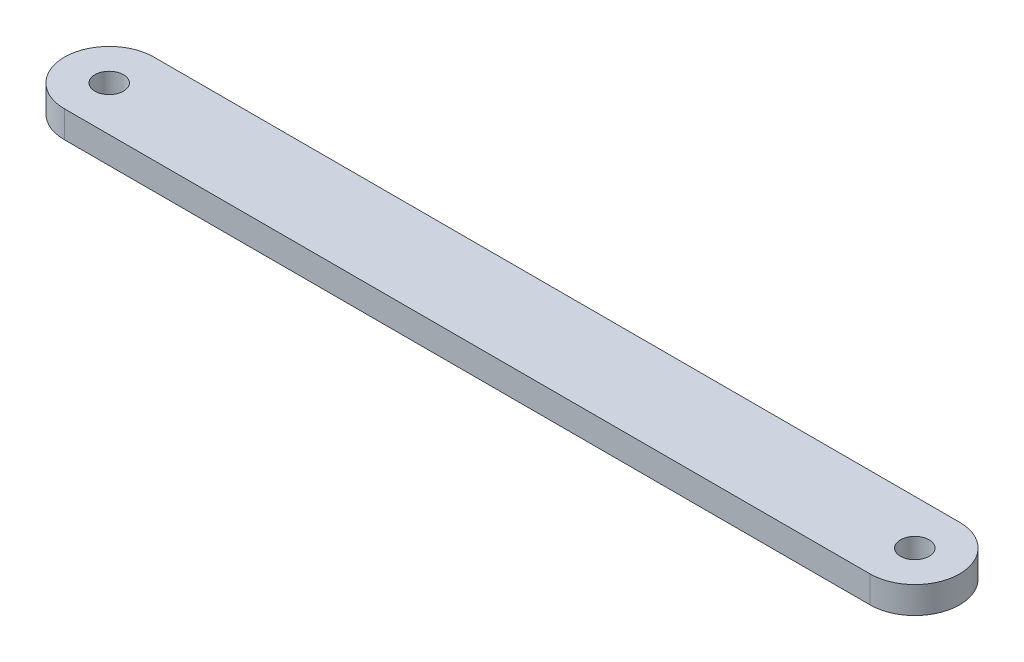
from build123d import *

# Parameters (mm, degrees)
SKETCH_1_R      = 1.6
EXTRUDE_1_DEPTH = 3


with BuildPart() as part:
    # ｽｹｯﾁ1 → ﾎﾞｽ - 押し出し1 (new body)
    with BuildSketch(Plane(origin=(0, 0, 0), x_dir=(1, 0, 0), z_dir=(0, 1, 0))):
        with BuildLine():
            Line((0, -5), (90, -5))
            ThreePointArc((90, -5), (95, 0), (90, 5))
            Line((90, 5), (0, 5))
            ThreePointArc((0, 5), (-5, 0), (0, -5))
        make_face()
        with Locations(Location((0, 0, 0), (0, 0, 270))):
            Circle(SKETCH_1_R, mode=Mode.SUBTRACT)
        with Locations(Location((90, 0, 0), (0, 0, 270))):
            Circle(SKETCH_1_R, mode=Mode.SUBTRACT)
    extrude(amount=EXTRUDE_1_DEPTH)


solid = part.part
